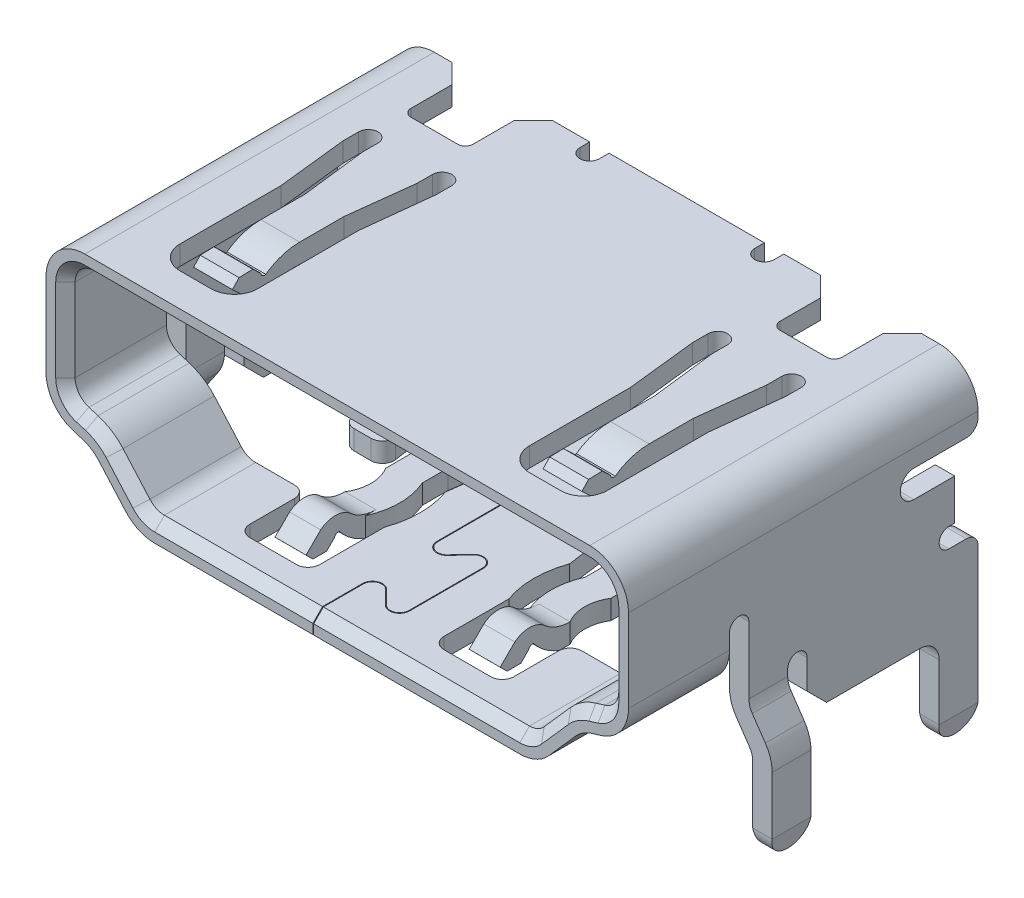
from build123d import *

# Parameters (mm, degrees)
RESSALTO_EXTRUS_O1_DEPTH      = 8.3
RESSALTO_EXTRUS_O1_DEPTH_BACK = 0.7
CHANFRO1_SIZE                 = 0.25
CORTE_EXTRUS_O1_DEPTH         = 3
RESSALTO_EXTRUS_O3_DEPTH      = 0.5
ESBO_O9_W                     = 0.5
ESBO_O9_H                     = 1
FILETE1_R                     = 0.499
FILETE1_OF_ESPELHAR3_R        = 0.499
CORTE_EXTRUS_O2_DEPTH         = 1
CORTE_EXTRUS_O3_DEPTH         = 1
CORTE_EXTRUS_O4_DEPTH         = 1
RESSALTO_EXTRUS_O4_DEPTH      = 0.8
RESSALTO_EXTRUS_O5_DEPTH      = 1
CORTE_EXTRUS_O5_DEPTH         = 11


with BuildPart() as part:
    # Esboço2 → Ressalto-extrusão1 (new, two sides: drawn at the far end of the back side and taken through both)
    with BuildSketch(Plane.XY.offset(-RESSALTO_EXTRUS_O1_DEPTH_BACK)):
        with BuildLine():
            Line((13.5, 2.775), (26.5, 2.775))
            ThreePointArc((26.5, 2.775), (27.207106781, 2.482106781), (27.5, 1.775))
            Line((27.5, 1.775), (27.5, -0.36))
            ThreePointArc((27.5, -0.36), (27.303276033, -0.95560693), (26.79050477, -1.316873544))
            Line((26.79050477, -1.316873544), (26.553545707, -1.388813811))
            ThreePointArc((26.553545707, -1.388813811), (26.328421757, -1.492872789), (26.140247155, -1.654425825))
            Line((26.140247155, -1.654425825), (25.449725383, -2.436749084))
            ThreePointArc((25.449725383, -2.436749084), (25.111248657, -2.686523199), (24.7, -2.775))
            Line((24.7, -2.775), (15.3, -2.775))
            ThreePointArc((15.3, -2.775), (14.888751343, -2.686523199), (14.550274617, -2.436749084))
            Line((14.550274617, -2.436749084), (13.859752845, -1.654425825))
            ThreePointArc((13.859752845, -1.654425825), (13.671578243, -1.492872789), (13.446454293, -1.388813811))
            Line((13.446454293, -1.388813811), (13.20949523, -1.316873544))
            ThreePointArc((13.20949523, -1.316873544), (12.696723967, -0.95560693), (12.5, -0.36))
            Line((12.5, -0.36), (12.5, 1.775))
            ThreePointArc((12.5, 1.775), (12.792893219, 2.482106781), (13.5, 2.775))
        make_face()
        with BuildLine():
            Line((13.5, 2.275), (26.5, 2.275))
            ThreePointArc((26.5, 2.275), (26.853553391, 2.128553391), (27, 1.775))
            Line((27, 1.775), (27, -0.36))
            ThreePointArc((27, -0.36), (26.901638017, -0.657803465), (26.645252385, -0.838436772))
            Line((26.645252385, -0.838436772), (26.408293321, -0.910377039))
            ThreePointArc((26.408293321, -0.910377039), (26.05810051, -1.072246561), (25.765384464, -1.323551283))
            Line((25.765384464, -1.323551283), (25.074862692, -2.105874542))
            ThreePointArc((25.074862692, -2.105874542), (24.905624329, -2.230761599), (24.7, -2.275))
            Line((24.7, -2.275), (15.3, -2.275))
            ThreePointArc((15.3, -2.275), (15.094375671, -2.230761599), (14.925137308, -2.105874542))
            Line((14.925137308, -2.105874542), (14.234615536, -1.323551283))
            ThreePointArc((14.234615536, -1.323551283), (13.94189949, -1.072246561), (13.591706679, -0.910377039))
            Line((13.591706679, -0.910377039), (13.354747615, -0.838436772))
            ThreePointArc((13.354747615, -0.838436772), (13.098361983, -0.657803465), (13, -0.36))
            Line((13, -0.36), (13, 1.775))
            ThreePointArc((13, 1.775), (13.146446609, 2.128553391), (13.5, 2.275))
        make_face(mode=Mode.SUBTRACT)
    extrude(amount=RESSALTO_EXTRUS_O1_DEPTH + RESSALTO_EXTRUS_O1_DEPTH_BACK)

    # Chanfro1
    chanfro1_edges = [part.edges().sort_by_distance(p)[0] for p in [
        (13.94189949, -1.072246561, 8.3),
        (14.579876422, -1.714712912, 8.3),
        (15.094375671, -2.230761599, 8.3),
        (20, -2.275, 8.3),
        (24.905624329, -2.230761599, 8.3),
        (25.420123578, -1.714712912, 8.3),
        (26.05810051, -1.072246561, 8.3),
        (26.526772853, -0.874406905, 8.3),
        (26.901638017, -0.657803465, 8.3),
        (27, 0.7075, 8.3),
        (26.853553391, 2.128553391, 8.3),
        (20, 2.275, 8.3),
        (13.146446609, 2.128553391, 8.3),
        (13, 0.7075, 8.3),
        (13.098361983, -0.657803465, 8.3),
        (13.473227147, -0.874406905, 8.3),
    ]]
    chamfer(chanfro1_edges, length=CHANFRO1_SIZE)

    # Esboço3 → Corte-extrusão1 (cut)
    with BuildSketch(Plane(origin=(27.5, 0, 0), x_dir=(0, 0, -1), z_dir=(1, 0, 0))):
        with BuildLine():
            Line((-5.7, 0.025), (-5.7, -4.040151325))
            Line((-5.7, -4.040151325), (-5.2, -4.040151325))
            Line((-5.2, -4.040151325), (1.122499897, -4.040151325))
            Line((1.122499897, -4.040151325), (1.122499897, -0.225))
            Line((1.122499897, -0.225), (1.122499897, 1.775))
            Line((1.122499897, 1.775), (0.7, 1.775))
            Line((0.7, 1.775), (0.7, 1.625))
            ThreePointArc((0.7, 1.625), (0.612132034, 1.412867966), (0.4, 1.325))
            Line((0.4, 1.325), (-0.95, 1.325))
            ThreePointArc((-0.95, 1.325), (-1.3, 0.975), (-0.95, 0.625))
            Line((-0.95, 0.625), (0.1, 0.625))
            Line((0.1, 0.625), (0.1, -0.225))
            Line((0.1, -0.225), (-5.2, -0.225))
            Line((-5.2, -0.225), (-5.2, 0.025))
            ThreePointArc((-5.2, 0.025), (-5.45, 0.275), (-5.7, 0.025))
        make_face()
    corte_extrus_o1 = extrude(amount=-CORTE_EXTRUS_O1_DEPTH, mode=Mode.SUBTRACT)

    # Espelhar1: Corte-extrusão1 across plane
    add(corte_extrus_o1.mirror(Plane.ZY.offset(-20)), mode=Mode.SUBTRACT)

    # Esboço6 → Ressalto-extrusão3 (add)
    with BuildSketch(Plane(origin=(27.5, 0, 0), x_dir=(0, 0, -1), z_dir=(1, 0, 0))):
        with BuildLine():
            Line((0.1, -0.225), (0.1, -0.425))
            Line((0.1, -0.425), (-0.05, -0.425))
            ThreePointArc((-0.05, -0.425), (-0.3, -0.675), (-0.05, -0.925))
            Line((-0.05, -0.925), (0.4, -0.925))
            ThreePointArc((0.4, -0.925), (0.612132034, -1.012867966), (0.7, -1.225))
            Line((0.7, -1.225), (0.7, -4.725))
            ThreePointArc((0.7, -4.725), (0.2, -5.225), (-0.3, -4.725))
            Line((-0.3, -4.725), (-0.3, -3.275))
            ThreePointArc((-0.3, -3.275), (-0.446446609, -2.921446609), (-0.8, -2.775))
            Line((-0.8, -2.775), (-3.2, -2.775))
            Line((-3.2, -2.775), (-3.7, -2.275))
            Line((-3.7, -2.275), (-3.7, -1.525))
            ThreePointArc((-3.7, -1.525), (-3.95, -1.275), (-4.2, -1.525))
            Line((-4.2, -1.525), (-4.2, -1.695))
            Line((-4.2, -1.695), (-5.2, -1.695))
            Line((-5.2, -1.695), (-5.2, -1.05080475))
            Line((-5.2, -1.05080475), (-5.2, -0.225))
            Line((-5.2, -0.225), (0.1, -0.225))
        make_face()
    ressalto_extrus_o3 = extrude(amount=-RESSALTO_EXTRUS_O3_DEPTH)

    # Espelhar2: Ressalto-extrusão3 across plane
    add(ressalto_extrus_o3.mirror(Plane.ZY.offset(-20)))

    # Varredura1: sweep along a path in Esboço8
    with BuildLine(Plane.XY.offset(5.2)) as varredura1_path:
        Line((27.849, -5.025), (27.849, -3.035))
        ThreePointArc((27.849, -3.035), (27.815578161, -2.813089059), (27.718, -2.611))
        Line((27.718, -2.611), (27.381, -2.119))
        ThreePointArc((27.381, -2.119), (27.283421839, -1.916910941), (27.25, -1.695))
    # Esboço9 → Varredura1 (sweep)
    with BuildSketch(Plane.XZ.offset(1.695)):
        with Locations((27.25, 4.7)):
            Rectangle(ESBO_O9_W, ESBO_O9_H)
    varredura1 = sweep(path=varredura1_path.line, transition=Transition.RIGHT)

    # Filete1
    filete1_edges = [part.edges().sort_by_distance(p)[0] for p in [
        (27.849, -5.025, 4.2),
        (27.849, -5.025, 5.2),
    ]]
    fillet(filete1_edges, radius=FILETE1_R)

    # Espelhar3: Varredura1 across plane
    add(varredura1.mirror(Plane.ZY.offset(-20)))

    # Filete1 of Espelhar3
    filete1_of_espelhar3_edges = [part.edges().sort_by_distance(p)[0] for p in [
        (12.151, -5.025, 4.2),
        (12.151, -5.025, 5.2),
    ]]
    fillet(filete1_of_espelhar3_edges, radius=FILETE1_OF_ESPELHAR3_R)

    # Esboço10 → Corte-extrusão2 (cut)
    with BuildSketch(Plane(origin=(0, 2.775, 0), x_dir=(1, 0, 0), z_dir=(0, 1, 0))):
        with BuildLine():
            Line((26.05, 0.7), (25.55, 0.2))
            Line((25.55, 0.2), (25.55, -0.85))
            ThreePointArc((25.55, -0.85), (25.491421356, -0.991421356), (25.35, -1.05))
            Line((25.35, -1.05), (24.15, -1.05))
            ThreePointArc((24.15, -1.05), (24.008578644, -0.991421356), (23.95, -0.85))
            Line((23.95, -0.85), (23.95, 0.2))
            Line((23.95, 0.2), (23.45, 0.7))
            Line((23.45, 0.7), (22.5, 0.7))
            Line((22.5, 0.7), (22.5, 0.45))
            ThreePointArc((22.5, 0.45), (22.25, 0.2), (22, 0.45))
            Line((22, 0.45), (22, 1.825806464))
            Line((22, 1.825806464), (26.05, 1.825806464))
            Line((26.05, 1.825806464), (26.05, 0.7))
        make_face()
        with BuildLine():
            Line((24.1, -7.45), (24.9, -7.45))
            ThreePointArc((24.9, -7.45), (25.324264069, -7.274264069), (25.5, -6.85))
            Line((25.5, -6.85), (25.5, -4.25))
            Line((25.5, -4.25), (25.7, -2.45))
            Line((25.7, -2.45), (25.7, -2.05))
            ThreePointArc((25.7, -2.05), (25.45, -1.8), (25.2, -2.05))
            Line((25.2, -2.05), (25.2, -2.45))
            Line((25.2, -2.45), (25, -4.13))
            Line((25, -4.13), (25, -4.25))
            Line((25, -4.25), (25, -5.2673))
            Line((25, -5.2673), (24, -5.2673))
            Line((24, -5.2673), (24, -4.25))
            Line((24, -4.25), (24, -4.13))
            Line((24, -4.13), (23.8, -2.45))
            Line((23.8, -2.45), (23.8, -2.05))
            ThreePointArc((23.8, -2.05), (23.55, -1.8), (23.3, -2.05))
            Line((23.3, -2.05), (23.3, -2.45))
            Line((23.3, -2.45), (23.5, -4.25))
            Line((23.5, -4.25), (23.5, -6.85))
            ThreePointArc((23.5, -6.85), (23.675735931, -7.274264069), (24.1, -7.45))
        make_face()
    corte_extrus_o2 = extrude(amount=-CORTE_EXTRUS_O2_DEPTH, mode=Mode.SUBTRACT)

    # Espelhar4: Corte-extrusão2 across plane
    add(corte_extrus_o2.mirror(Plane.ZY.offset(-20)), mode=Mode.SUBTRACT)

    # Esboço11 → Corte-extrusão3 (cut)
    with BuildSketch(Plane.XZ.offset(2.775)):
        with BuildLine():
            Line((15.5, 5.7), (16.3, 5.7))
            ThreePointArc((16.3, 5.7), (16.512132034, 5.787867966), (16.6, 6))
            Line((16.6, 6), (16.6, 7.15))
            ThreePointArc((16.6, 7.15), (16.687867966, 7.362132034), (16.9, 7.45))
            Line((16.9, 7.45), (18.1, 7.45))
            ThreePointArc((18.1, 7.45), (18.312132034, 7.362132034), (18.4, 7.15))
            Line((18.4, 7.15), (18.4, 5.482))
            ThreePointArc((18.4, 5.482), (18.537021498, 4.7), (18.4, 3.918))
            Line((18.4, 3.918), (18.6, 2.45))
            Line((18.6, 2.45), (18.6, 1.95))
            ThreePointArc((18.6, 1.95), (18.35, 1.7), (18.1, 1.95))
            Line((18.1, 1.95), (17.9, 3.35))
            Line((17.9, 3.35), (17.9, 4.01))
            ThreePointArc((17.9, 4.01), (18.055740215, 4.7424), (17.9, 5.4748))
            Line((17.9, 5.4748), (17.1, 5.4748))
            Line((17.1, 5.4748), (17.1, 5.2048))
            ThreePointArc((17.1, 5.2048), (17.249484511, 4.67885), (17.1, 4.1529))
            Line((17.1, 4.1529), (17.1, 3.3272))
            Line((17.1, 3.3272), (16.9105, 1.9257))
            ThreePointArc((16.9105, 1.9257), (16.6605, 1.6757), (16.4105, 1.9257))
            Line((16.4105, 1.9257), (16.4105, 2.4257))
            Line((16.4105, 2.4257), (16.5376, 3.3341))
            ThreePointArc((16.5376, 3.3341), (16.466861376, 3.572574941), (16.2405, 3.6757))
            Line((16.2405, 3.6757), (15.8106, 3.6757))
            ThreePointArc((15.8106, 3.6757), (15.598467966, 3.587832034), (15.5106, 3.3757))
            Line((15.5106, 3.3757), (15.5106, 1.3757))
            Line((15.5106, 1.3757), (16.0106, 0.8757))
            Line((16.0106, 0.8757), (17.7106, 0.8757))
            ThreePointArc((17.7106, 0.8757), (17.922732034, 0.787832034), (18.0106, 0.5757))
            Line((18.0106, 0.5757), (18.0106, 0.3757))
            ThreePointArc((18.0106, 0.3757), (18.098467966, 0.163567966), (18.3106, 0.0757))
            Line((18.3106, 0.0757), (20, 0.0757))
            Line((20, 0.0757), (20, -1.100530022))
            Line((20, -1.100530022), (14.919265786, -1.100530022))
            Line((14.919265786, -1.100530022), (14.919265786, 5.2048))
            Line((14.919265786, 5.2048), (15.5, 5.7))
        make_face()
    corte_extrus_o3 = extrude(amount=-CORTE_EXTRUS_O3_DEPTH, mode=Mode.SUBTRACT)

    # Espelhar5: Corte-extrusão3 across plane
    add(corte_extrus_o3.mirror(Plane.ZY.offset(-20)), mode=Mode.SUBTRACT)

    # Esboço12 → Corte-extrusão4 (cut)
    with BuildSketch(Plane.XZ.offset(2.775)):
        with BuildLine():
            Line((19.4106, -0.117707226), (19.4106, 1.3257))
            ThreePointArc((19.4106, 1.3257), (19.55986004, 1.547848771), (19.82196, 1.493698543))
            Line((19.82196, 1.493698543), (20.164857851, 1.143800735))
            ThreePointArc((20.164857851, 1.143800735), (20.448800933, 1.085135514), (20.6105, 1.325798543))
            Line((20.6105, 1.325798543), (20.6105, 3.2258))
            ThreePointArc((20.6105, 3.2258), (20.448803028, 3.46646363), (20.16486, 3.407801457))
            Line((20.16486, 3.407801457), (19.821957851, 3.057899265))
            ThreePointArc((19.821957851, 3.057899265), (19.559857945, 3.003752084), (19.4106, 3.225901457))
            Line((19.4106, 3.225901457), (19.4106, 5.1259))
            ThreePointArc((19.4106, 5.1259), (19.559797725, 5.348023312), (19.821865712, 5.293994643))
            Line((19.821865712, 5.293994643), (20.146784929, 4.944096638))
            ThreePointArc((20.146784929, 4.944096638), (20.430759842, 4.885310137), (20.59252107, 5.125998543))
            Line((20.59252107, 5.125998543), (20.59252107, 7.026))
            ThreePointArc((20.59252107, 7.026), (20.430824098, 7.26666363), (20.14688107, 7.208001457))
            Line((20.14688107, 7.208001457), (19.803978921, 6.858099265))
            ThreePointArc((19.803978921, 6.858099265), (19.541879015, 6.803952084), (19.39262107, 7.026101457))
            Line((19.39262107, 7.026101457), (19.39262107, 9.06575703))
            ThreePointArc((19.39262107, 9.06575703), (19.38262107, 9.07575703), (19.37262107, 9.06575703))
            Line((19.37262107, 9.06575703), (19.37262107, 7.026098543))
            ThreePointArc((19.37262107, 7.026098543), (19.534320137, 6.785435514), (19.818263219, 6.844100735))
            Line((19.818263219, 6.844100735), (20.16116107, 7.193998543))
            ThreePointArc((20.16116107, 7.193998543), (20.42326103, 7.248148771), (20.57252107, 7.026))
            Line((20.57252107, 7.026), (20.57252107, 5.126001457))
            ThreePointArc((20.57252107, 5.126001457), (20.423324019, 4.903876964), (20.161255358, 4.957905357))
            Line((20.161255358, 4.957905357), (19.836336141, 5.307803362))
            ThreePointArc((19.836336141, 5.307803362), (19.552360554, 5.366589588), (19.3906, 5.1259))
            Line((19.3906, 5.1259), (19.3906, 3.225898543))
            ThreePointArc((19.3906, 3.225898543), (19.552299067, 2.985235514), (19.836242149, 3.043900735))
            Line((19.836242149, 3.043900735), (20.17914, 3.393798543))
            ThreePointArc((20.17914, 3.393798543), (20.44123996, 3.447948771), (20.5905, 3.2258))
            Line((20.5905, 3.2258), (20.5905, 1.325801457))
            ThreePointArc((20.5905, 1.325801457), (20.441242055, 1.103652084), (20.179142149, 1.157799265))
            Line((20.179142149, 1.157799265), (19.83624, 1.507701457))
            ThreePointArc((19.83624, 1.507701457), (19.552296972, 1.56636363), (19.3906, 1.3257))
            Line((19.3906, 1.3257), (19.3906, -0.117707226))
            ThreePointArc((19.3906, -0.117707226), (19.4006, -0.127707226), (19.4106, -0.117707226))
        make_face()
    extrude(amount=-CORTE_EXTRUS_O4_DEPTH, mode=Mode.SUBTRACT)

    # Esboço14 → Ressalto-extrusão4 (add)
    with BuildSketch(Plane(origin=(22.9, 0, 0), x_dir=(0, 0, -1), z_dir=(1, 0, 0))):
        with BuildLine():
            Line((-5.2048, -2.275), (-5.2048, -2.775))
            Line((-5.2048, -2.775), (-5.4748, -2.775))
            ThreePointArc((-5.4748, -2.775), (-5.841679986, -2.580565027), (-6.1412, -2.293))
            ThreePointArc((-6.1412, -2.293), (-6.224464799, -2.298955914), (-6.2742, -2.366))
            Line((-6.2742, -2.366), (-6.4736, -2.5647))
            Line((-6.4736, -2.5647), (-6.8272, -2.5647))
            Line((-6.8272, -2.5647), (-7.0036, -2.3876))
            Line((-7.0036, -2.3876), (-6.627, -2.0125))
            ThreePointArc((-6.627, -2.0125), (-6.219665294, -1.882151027), (-5.829, -2.0562))
            ThreePointArc((-5.829, -2.0562), (-5.535514016, -2.218702692), (-5.2048, -2.275))
        make_face()
    ressalto_extrus_o4 = extrude(amount=-RESSALTO_EXTRUS_O4_DEPTH)

    # Esboço15 → Ressalto-extrusão5 (add)
    with BuildSketch(Plane(origin=(25, 0, 0), x_dir=(0, 0, -1), z_dir=(1, 0, 0))):
        with BuildLine():
            Line((-5.2673, 2.275), (-5.2673, 2.775))
            ThreePointArc((-5.2673, 2.775), (-5.726561738, 2.702927261), (-6.1417, 2.4937))
            ThreePointArc((-6.1417, 2.4937), (-6.224873413, 2.506754104), (-6.2686, 2.5787))
            Line((-6.2686, 2.5787), (-6.475, 2.7735))
            Line((-6.475, 2.7735), (-6.8284, 2.7633))
            Line((-6.8284, 2.7633), (-7, 2.5815))
            Line((-7, 2.5815), (-6.6118, 2.2151))
            ThreePointArc((-6.6118, 2.2151), (-6.240173676, 2.052824535), (-5.8502, 2.164))
            ThreePointArc((-5.8502, 2.164), (-5.56717269, 2.263730503), (-5.2673, 2.275))
        make_face()
    ressalto_extrus_o5 = extrude(amount=-RESSALTO_EXTRUS_O5_DEPTH)

    # Espelhar6: Ressalto-extrusão4, Ressalto-extrusão5 across plane
    add(ressalto_extrus_o4.mirror(Plane.ZY.offset(-20)))
    add(ressalto_extrus_o5.mirror(Plane.ZY.offset(-20)))

    # Esboço16 → Corte-extrusão5 (cut)
    with BuildSketch(Plane.XY.offset(5.2)):
        Polygon((28.099, -4.526), (27.999, -5.025), (27.699, -5.025), (27.599, -4.526), (27.555323028, -4.526), (27.5, -4.725), (27.4, -5.225), (27.1, -5.225), (27, -4.725), (26.815237852, -4.725), (26.815237852, -5.379816457), (28.2402866, -5.379816457), (28.2402866, -4.526), align=None)
    corte_extrus_o5 = extrude(amount=-CORTE_EXTRUS_O5_DEPTH, mode=Mode.SUBTRACT)

    # Espelhar7: Corte-extrusão5 across plane
    add(corte_extrus_o5.mirror(Plane.ZY.offset(-20)), mode=Mode.SUBTRACT)


solid = part.part
